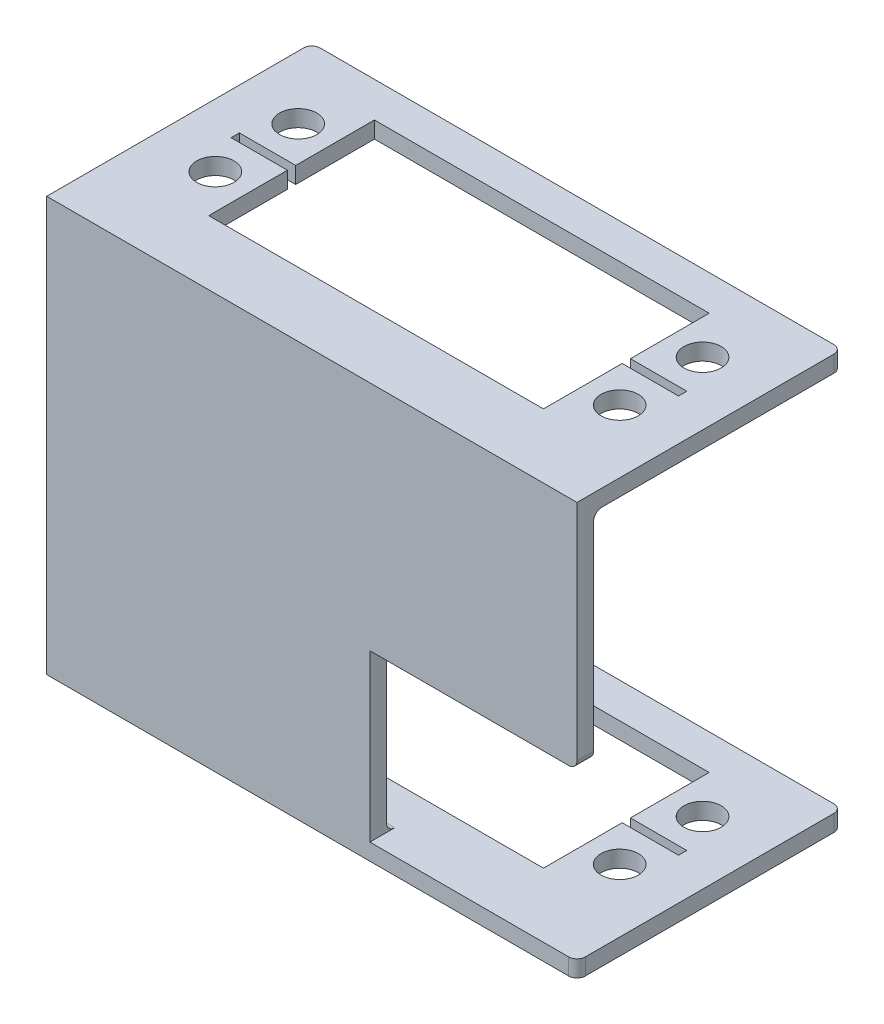
from build123d import *

# Parameters (mm, degrees)
SKETCH1_W               = 100
SKETCH1_H               = 32
BOSS_EXTRUDE1_DEPTH     = 2
SKETCH2_W               = 100
SKETCH2_H               = 2
BOSS_EXTRUDE2_DEPTH     = 46
SKETCH3_W               = 100
SKETCH3_H               = 2
BOSS_EXTRUDE3_DEPTH     = 32
CUT_EXTRUDE1_DEPTH      = 117.292734081
CUT_EXTRUDE1_DEPTH_BACK = 117.292734081
SKETCH4_R               = 2.25
CUT_EXTRUDE2_DEPTH      = 117.292734081
CUT_EXTRUDE2_DEPTH_BACK = 117.292734081
SKETCH5_W               = 36
SKETCH5_H               = 32
SKETCH6_W               = 25
SKETCH6_H               = 20
CUT_EXTRUDE3_DEPTH      = 2
FILLET1_R               = 1


with BuildPart() as part:
    # Sketch1 → Boss-Extrude1 (new body)
    with BuildSketch(Plane(origin=(0, 0, 0), x_dir=(1, 0, 0), z_dir=(0, 1, 0))):
        with Locations((50, 16)):
            Rectangle(SKETCH1_W, SKETCH1_H)
    extrude(amount=BOSS_EXTRUDE1_DEPTH)

    # Sketch2 → Boss-Extrude2 (add)
    with BuildSketch(Plane.XZ):
        with Locations((50, -1)):
            Rectangle(SKETCH2_W, SKETCH2_H)
    extrude(amount=BOSS_EXTRUDE2_DEPTH)

    # Sketch3 → Boss-Extrude3 (add)
    with BuildSketch(Plane.XY):
        with Locations((50, -47)):
            Rectangle(SKETCH3_W, SKETCH3_H)
    extrude(amount=-BOSS_EXTRUDE3_DEPTH)

    # Sketch4 → Cut-Extrude1 (cut, two sides: drawn at the far end of the back side and taken through both)
    with BuildSketch(Plane(origin=(0, 2, 0), x_dir=(1, 0, 0), z_dir=(0, 1, 0)).offset(-CUT_EXTRUDE1_DEPTH_BACK)):
        with Locations(Location((7.6, 22.75, 0), (0, 0, 270))):
            Circle(SKETCH4_R)
        with Locations(Location((56.4, 22.75, 0), (0, 0, 270))):
            Circle(SKETCH4_R)
        with Locations(Location((56.4, 12.75, 0), (0, 0, 270))):
            Circle(SKETCH4_R)
        Polygon((52.2, 17.25), (59, 17.25), (59, 18.25), (52.2, 18.25), (52.2, 27.75), (11.8, 27.75), (11.8, 18.25), (5, 18.25), (5, 17.25), (11.8, 17.25), (11.8, 7.75), (52.2, 7.75), align=None)
        with Locations(Location((7.6, 12.75, 0), (0, 0, 270))):
            Circle(SKETCH4_R)
    extrude(amount=CUT_EXTRUDE1_DEPTH + CUT_EXTRUDE1_DEPTH_BACK, mode=Mode.SUBTRACT)

    # Sketch5 → Cut-Extrude2 (cut, two sides: drawn at the far end of the back side and taken through both)
    with BuildSketch(Plane.XZ.offset(48).offset(-CUT_EXTRUDE2_DEPTH_BACK)):
        with Locations((82, -16)):
            Rectangle(SKETCH5_W, SKETCH5_H)
    extrude(amount=CUT_EXTRUDE2_DEPTH + CUT_EXTRUDE2_DEPTH_BACK, mode=Mode.SUBTRACT)

    # Sketch6 → Cut-Extrude3 (cut)
    with BuildSketch(Plane(origin=(0, 0, -2), x_dir=(-1, 0, 0), z_dir=(0, 0, -1))):
        with Locations((-51.5, -36)):
            Rectangle(SKETCH6_W, SKETCH6_H)
    extrude(amount=-CUT_EXTRUDE3_DEPTH, mode=Mode.SUBTRACT)

    # Fillet1
    fillet1_edges = [part.edges().sort_by_distance(p)[0] for p in [
        (0, 1, -32),
        (0, -47, -32),
        (64, -47, -32),
        (64, 1, -32),
        (32, 0, -2),
        (19.5, -46, -2),
        (64, -47, 0),
        (64, -26, -1),
    ]]
    fillet(fillet1_edges, radius=FILLET1_R)


solid = part.part
